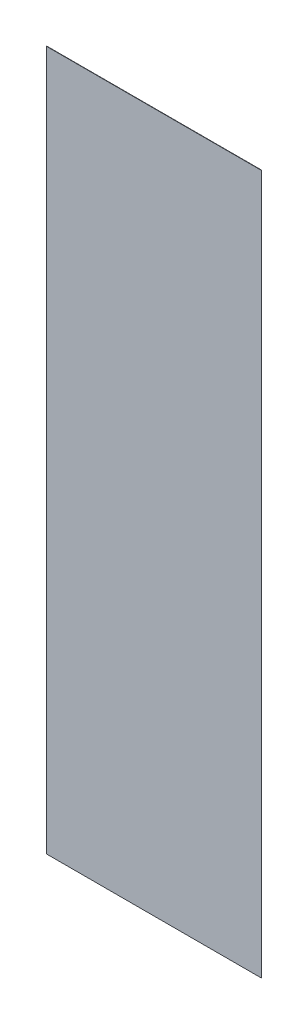
from build123d import *

# Parameters (mm, degrees)
CROQUIS1_W              = 750
CROQUIS1_H              = 2440
SALIENTE_EXTRUIR1_DEPTH = 1.21


with BuildPart() as part:
    # Croquis1 → Saliente-Extruir1 (new body)
    with BuildSketch(Plane.XY):
        with Locations((375, -1220)):
            Rectangle(CROQUIS1_W, CROQUIS1_H)
    extrude(amount=SALIENTE_EXTRUIR1_DEPTH)


solid = part.part
